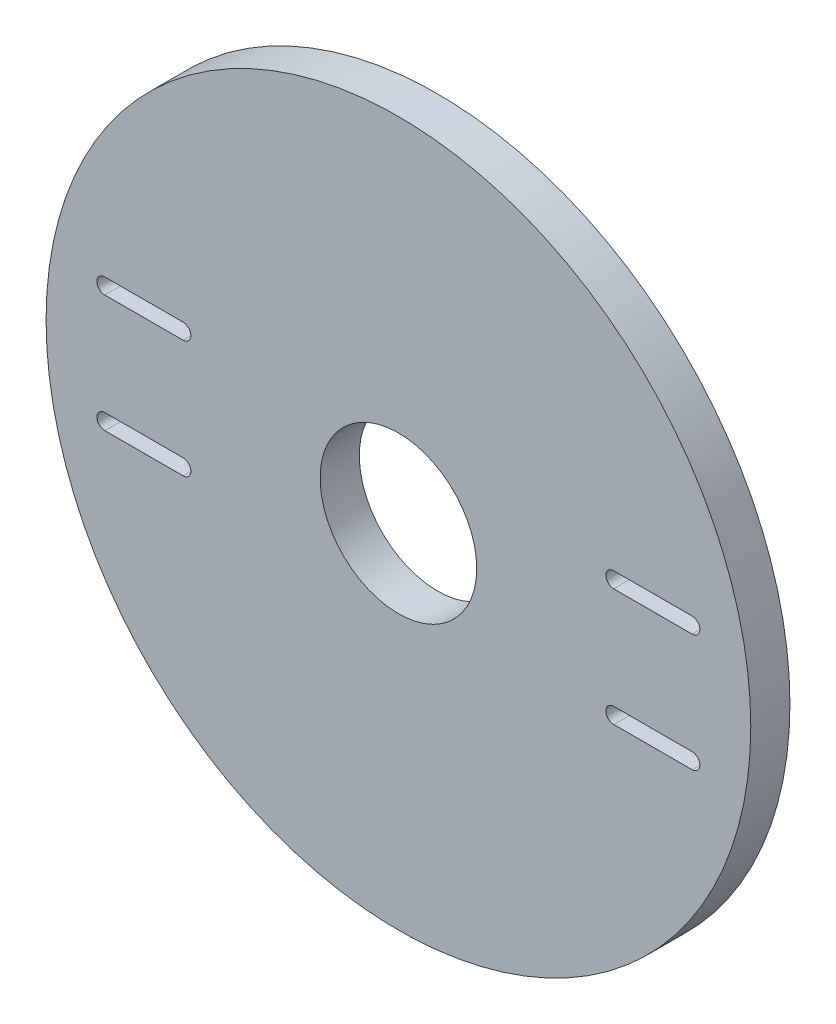
from build123d import *

# Parameters (mm, degrees)
SKETCH_1_R          = 180
EXTRUDE_1_DEPTH     = 20
SKETCH_3_R          = 40
CUT_EXTRUDE_2_DEPTH = 254
CUT_EXTRUDE_3_REACH = 257.343


with BuildPart() as part:
    # 草图1 → 凸台-拉伸1 (new body)
    with BuildSketch(Plane.XY):
        Circle(SKETCH_1_R)
    extrude(amount=EXTRUDE_1_DEPTH)

    # 草图3 → 切除-拉伸2 (cut)
    with BuildSketch(Plane.XY.offset(20)):
        Circle(SKETCH_3_R)
    extrude(amount=-CUT_EXTRUDE_2_DEPTH, mode=Mode.SUBTRACT)

    # 草图2 → 切除-拉伸3 (cut, up to next)
    with BuildSketch(Plane.XY.offset(20), mode=Mode.PRIVATE) as cut_extrude_3_sk1:
        with BuildLine():
            Line((-110, 34), (-150, 34))
            ThreePointArc((-150, 34), (-154, 30), (-150, 26))
            Line((-150, 26), (-110, 26))
            ThreePointArc((-110, 26), (-106, 30), (-110, 34))
        make_face()
    cut_extrude_3_tool1 = extrude(cut_extrude_3_sk1.sketch, amount=-CUT_EXTRUDE_3_REACH, mode=Mode.PRIVATE) & part.part
    # 草图2 → 切除-拉伸3 (cut, up to next)
    with BuildSketch(Plane.XY.offset(20), mode=Mode.PRIVATE) as cut_extrude_3_sk2:
        with BuildLine():
            Line((-110, -34), (-150, -34))
            ThreePointArc((-150, -34), (-154, -30), (-150, -26))
            Line((-150, -26), (-110, -26))
            ThreePointArc((-110, -26), (-106, -30), (-110, -34))
        make_face()
    cut_extrude_3_tool2 = extrude(cut_extrude_3_sk2.sketch, amount=-CUT_EXTRUDE_3_REACH, mode=Mode.PRIVATE) & part.part
    # 草图2 → 切除-拉伸3 (cut, up to next)
    with BuildSketch(Plane.XY.offset(20), mode=Mode.PRIVATE) as cut_extrude_3_sk3:
        with BuildLine():
            Line((110, 34), (150, 34))
            ThreePointArc((150, 34), (154, 30), (150, 26))
            Line((150, 26), (110, 26))
            ThreePointArc((110, 26), (106, 30), (110, 34))
        make_face()
    cut_extrude_3_tool3 = extrude(cut_extrude_3_sk3.sketch, amount=-CUT_EXTRUDE_3_REACH, mode=Mode.PRIVATE) & part.part
    # 草图2 → 切除-拉伸3 (cut, up to next)
    with BuildSketch(Plane.XY.offset(20), mode=Mode.PRIVATE) as cut_extrude_3_sk4:
        with BuildLine():
            Line((110, -34), (150, -34))
            ThreePointArc((150, -34), (154, -30), (150, -26))
            Line((150, -26), (110, -26))
            ThreePointArc((110, -26), (106, -30), (110, -34))
        make_face()
    cut_extrude_3_tool4 = extrude(cut_extrude_3_sk4.sketch, amount=-CUT_EXTRUDE_3_REACH, mode=Mode.PRIVATE) & part.part
    add(cut_extrude_3_tool1.solids().sort_by_distance((-130, 30, 20))[0], mode=Mode.SUBTRACT)
    add(cut_extrude_3_tool2.solids().sort_by_distance((-130, -30, 20))[0], mode=Mode.SUBTRACT)
    add(cut_extrude_3_tool3.solids().sort_by_distance((130, 30, 20))[0], mode=Mode.SUBTRACT)
    add(cut_extrude_3_tool4.solids().sort_by_distance((130, -30, 20))[0], mode=Mode.SUBTRACT)


solid = part.part
